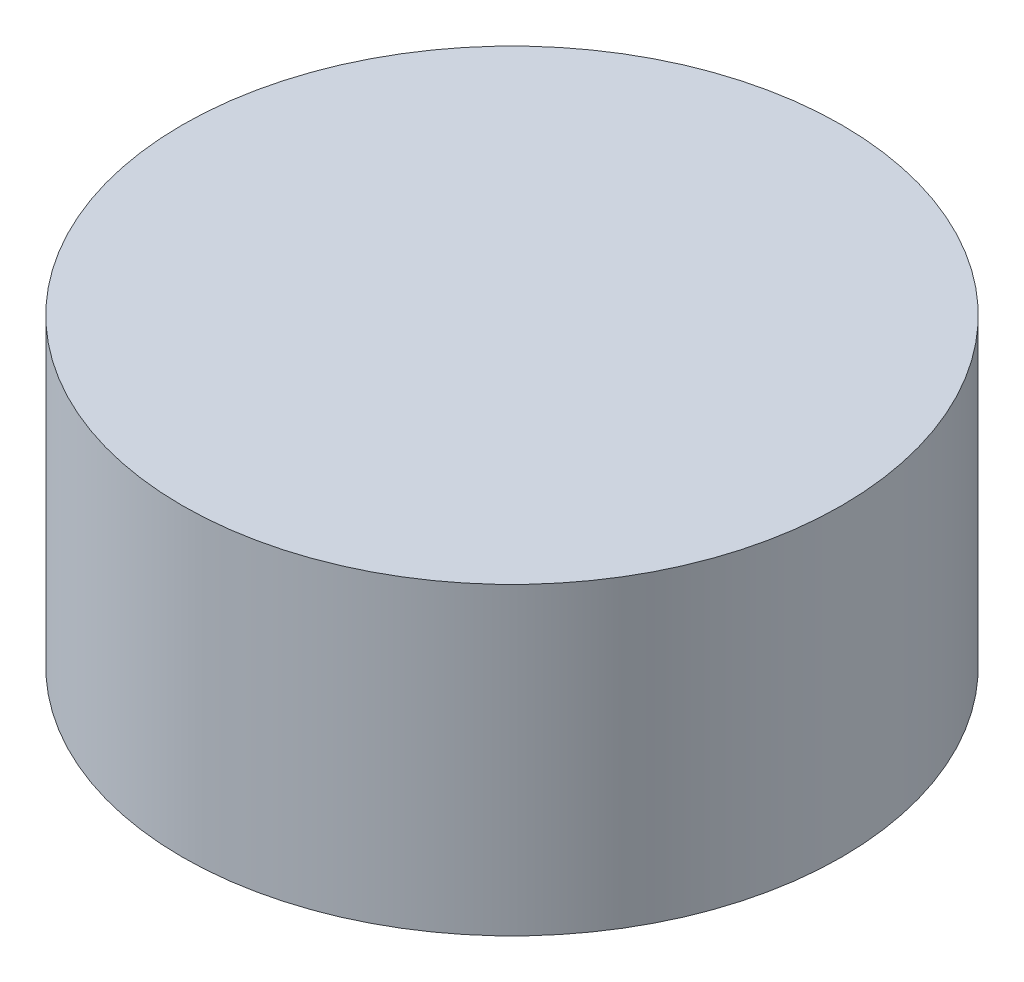
from build123d import *

# Parameters (mm, degrees)
SKETCH_1_R      = 64.982019502
EXTRUDE_3_DEPTH = 60


with BuildPart() as part:
    # 草圖1 → 填料-伸長3 (new body)
    with BuildSketch(Plane(origin=(0, 0, 0), x_dir=(1, 0, 0), z_dir=(0, 1, 0))):
        with Locations(Location((0, 0, 0), (0, 0, 270))):
            Circle(SKETCH_1_R)
    extrude(amount=EXTRUDE_3_DEPTH)


solid = part.part
